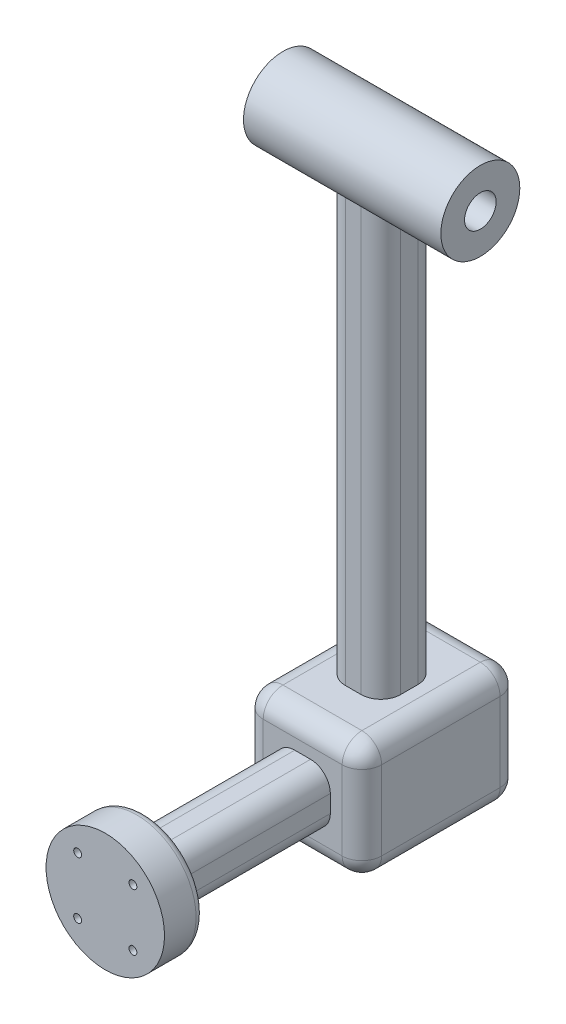
from build123d import *

# Parameters (mm, degrees)
SKETCH1_W               = 38.1
SKETCH1_H               = 38.1
BOSS_EXTRUDE1_DEPTH     = 50.8
SKETCH2_W               = 17.78
SKETCH2_H               = 18.288
BOSS_EXTRUDE2_DEPTH     = 50.8
SKETCH3_R               = 19.05
BOSS_EXTRUDE3_DEPTH     = 12.7
SKETCH4_W               = 17.78
SKETCH4_H               = 18.288
BOSS_EXTRUDE4_DEPTH     = 137.16
SKETCH6_R               = 12.7
BOSS_EXTRUDE5_DEPTH     = 31.75
SKETCH7_R               = 5.08
CUT_EXTRUDE1_DEPTH      = 63.5
SKETCH8_R               = 1.27
CUT_EXTRUDE2_DEPTH      = 10.16
SKETCH8_3_R             = 1.27
CUT_EXTRUDE3_DEPTH      = 10.16
SKETCH8_4_R             = 1.27
CUT_EXTRUDE4_DEPTH      = 10.16
SKETCH8_5_R             = 1.27
CUT_EXTRUDE5_DEPTH      = 10.16
FILLET1_R               = 6.35
SKETCH10_R              = 1.905
CUT_EXTRUDE6_DEPTH      = 2.54
MIRROR2_COPY_1_SKETCH_R = 1.905
MIRROR2_COPY_1_DEPTH    = 2.54
MIRROR2_COPY_2_SKETCH_R = 1.905
MIRROR2_COPY_2_DEPTH    = 2.54
FILLET2_R               = 2.54


with BuildPart() as part:
    # Sketch1 → Boss-Extrude1 (new body)
    with BuildSketch(Plane.XY):
        Rectangle(SKETCH1_W, SKETCH1_H)
    extrude(amount=BOSS_EXTRUDE1_DEPTH)

    # Sketch2 → Boss-Extrude2 (add)
    with BuildSketch(Plane.XY.offset(50.8)):
        Rectangle(SKETCH2_W, SKETCH2_H)
    extrude(amount=BOSS_EXTRUDE2_DEPTH)

    # Sketch3 → Boss-Extrude3 (add)
    with BuildSketch(Plane.XY.offset(101.6)):
        Circle(SKETCH3_R)
    extrude(amount=BOSS_EXTRUDE3_DEPTH)

    # Sketch4 → Boss-Extrude4 (add)
    with BuildSketch(Plane(origin=(0, 19.05, 0), x_dir=(1, 0, 0), z_dir=(0, 1, 0))):
        with Locations((0, -25.4)):
            Rectangle(SKETCH4_W, SKETCH4_H)
    extrude(amount=BOSS_EXTRUDE4_DEPTH)

    # Sketch6 → Boss-Extrude5 (add, symmetric)
    with BuildSketch(Plane(origin=(0, 0, 0), x_dir=(0, 0, -1), z_dir=(1, 0, 0))):
        with Locations((-25.4, 163.83)):
            Circle(SKETCH6_R)
    extrude(amount=BOSS_EXTRUDE5_DEPTH, both=True)

    # Sketch7 → Cut-Extrude1 (cut)
    with BuildSketch(Plane(origin=(31.75, 0, 0), x_dir=(0, 0, -1), z_dir=(1, 0, 0))):
        with Locations((-25.4, 163.83)):
            Circle(SKETCH7_R)
    extrude(amount=-CUT_EXTRUDE1_DEPTH, mode=Mode.SUBTRACT)

    # Sketch8 → Cut-Extrude2 (cut)
    with BuildSketch(Plane.XY.offset(114.3)):
        with Locations((8.89, 9.144)):
            Circle(SKETCH8_R)
    extrude(amount=-CUT_EXTRUDE2_DEPTH, mode=Mode.SUBTRACT)

    # Sketch8<3> → Cut-Extrude3 (cut)
    with BuildSketch(Plane.XY.offset(114.3)):
        with Locations((8.89, -9.144)):
            Circle(SKETCH8_3_R)
    extrude(amount=-CUT_EXTRUDE3_DEPTH, mode=Mode.SUBTRACT)

    # Sketch8<4> → Cut-Extrude4 (cut)
    with BuildSketch(Plane.XY.offset(114.3)):
        with Locations((-8.89, -9.144)):
            Circle(SKETCH8_4_R)
    extrude(amount=-CUT_EXTRUDE4_DEPTH, mode=Mode.SUBTRACT)

    # Sketch8<5> → Cut-Extrude5 (cut)
    with BuildSketch(Plane.XY.offset(114.3)):
        with Locations((-8.89, 9.144)):
            Circle(SKETCH8_5_R)
    extrude(amount=-CUT_EXTRUDE5_DEPTH, mode=Mode.SUBTRACT)

    # Fillet1
    fillet1_edges = [part.edges().sort_by_distance(p)[0] for p in [
        (-19.05, 19.05, 25.4),
        (-19.05, 0, 50.8),
        (-19.05, -19.05, 25.4),
        (-19.05, 0, 0),
        (8.89, -9.144, 76.2),
        (8.89, 9.144, 76.2),
        (-8.89, -9.144, 76.2),
        (0, 19.05, 50.8),
        (-8.89, 9.144, 76.2),
        (0, -19.05, 0),
        (0, 19.05, 0),
        (19.05, 19.05, 25.4),
        (19.05, 0, 0),
        (19.05, -19.05, 25.4),
        (0, -19.05, 50.8),
        (19.05, 0, 50.8),
        (-8.89, 87.0332647, 34.544),
        (-8.89, 87.0332647, 16.256),
        (8.89, 87.0332647, 16.256),
        (8.89, 87.0332647, 34.544),
    ]]
    fillet(fillet1_edges, radius=FILLET1_R)

    # Sketch10 → Cut-Extrude6 (cut)
    with BuildSketch(Plane.XY.offset(104.14)):
        with Locations((-8.89, -9.144)):
            Circle(SKETCH10_R)
    cut_extrude6 = extrude(amount=-CUT_EXTRUDE6_DEPTH, mode=Mode.SUBTRACT)

    # Mirror1: Cut-Extrude6 across plane
    add(cut_extrude6.mirror(Plane.ZX), mode=Mode.SUBTRACT)

    # Mirror2 copy 1 sketch → Mirror2 copy 1 (cut)
    with BuildSketch(Plane(origin=(0, 0, 104.14), x_dir=(-1, 0, 0), z_dir=(0, 0, 1))):
        with Locations((-8.89, -9.144)):
            Circle(MIRROR2_COPY_1_SKETCH_R)
    extrude(amount=-MIRROR2_COPY_1_DEPTH, mode=Mode.SUBTRACT)

    # Mirror2 copy 2 sketch → Mirror2 copy 2 (cut)
    with BuildSketch(Plane(origin=(0, 0, 104.14), x_dir=(-1, 0, 0), z_dir=(0, 0, 1))):
        with Locations((-8.89, 9.144)):
            Circle(MIRROR2_COPY_2_SKETCH_R)
    extrude(amount=-MIRROR2_COPY_2_DEPTH, mode=Mode.SUBTRACT)

    # Fillet2
    fillet2_edges = [part.edges().sort_by_distance(p)[0] for p in [
        (-19.05, 0, 101.6),
    ]]
    fillet(fillet2_edges, radius=FILLET2_R)


solid = part.part
